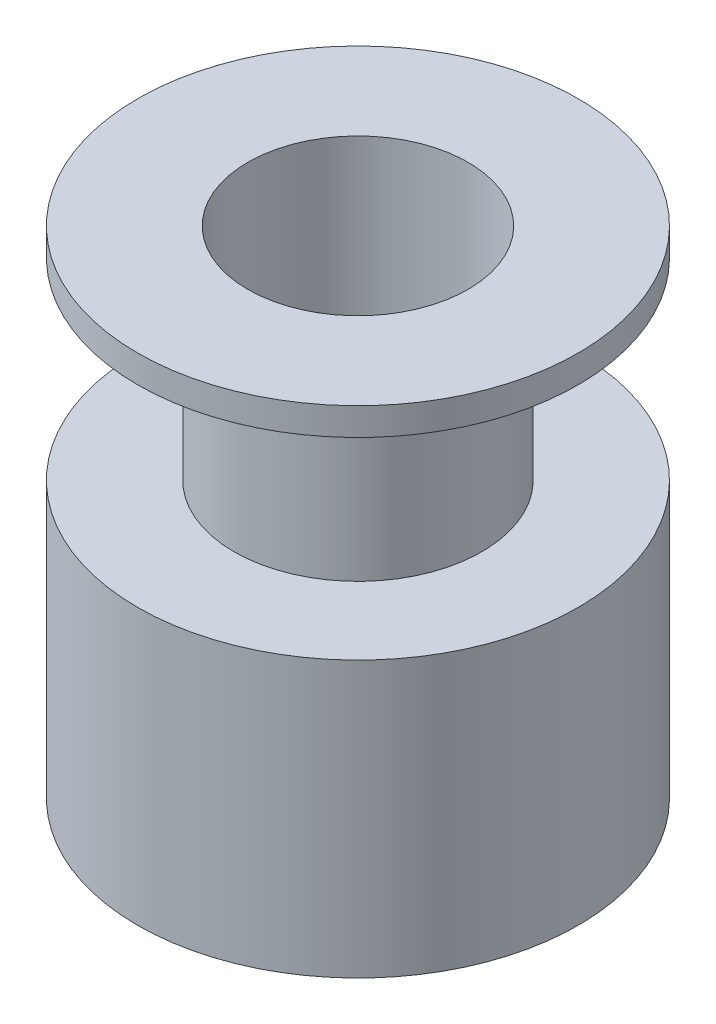
from build123d import *

# Parameters (mm, degrees)
SKETCH1_R           = 8
BOSS_EXTRUDE1_DEPTH = 18
SKETCH2_R           = 4
CUT_EXTRUDE1_DEPTH  = 22.260291625
CUT_EXTRUDE2_START  = -8
SKETCH3_R           = 8
SKETCH3_R_2         = 4.5
CUT_EXTRUDE2_DEPTH  = 7


with BuildPart() as part:
    # Sketch1 → Boss-Extrude1 (new body)
    with BuildSketch(Plane(origin=(0, 0, 0), x_dir=(1, 0, 0), z_dir=(0, 1, 0))):
        with Locations(Location((0, 0, 0), (0, 0, 270))):
            Circle(SKETCH1_R)
    extrude(amount=BOSS_EXTRUDE1_DEPTH)

    # Sketch2 → Cut-Extrude1 (cut, through all)
    with BuildSketch(Plane(origin=(0, 18, 0), x_dir=(1, 0, 0), z_dir=(0, 1, 0))):
        with Locations(Location((0, 0, 0), (0, 0, 270))):
            Circle(SKETCH2_R)
    extrude(amount=-CUT_EXTRUDE1_DEPTH, mode=Mode.SUBTRACT)

    # Sketch3 → Cut-Extrude2 (cut)
    with BuildSketch(Plane(origin=(0, 18, 0), x_dir=(1, 0, 0), z_dir=(0, 1, 0)).offset(CUT_EXTRUDE2_START)):
        with Locations(Location((0, 0, 0), (0, 0, 270))):
            Circle(SKETCH3_R)
        with Locations(Location((0, 0, 0), (0, 0, 270))):
            Circle(SKETCH3_R_2, mode=Mode.SUBTRACT)
    extrude(amount=CUT_EXTRUDE2_DEPTH, mode=Mode.SUBTRACT)


solid = part.part
